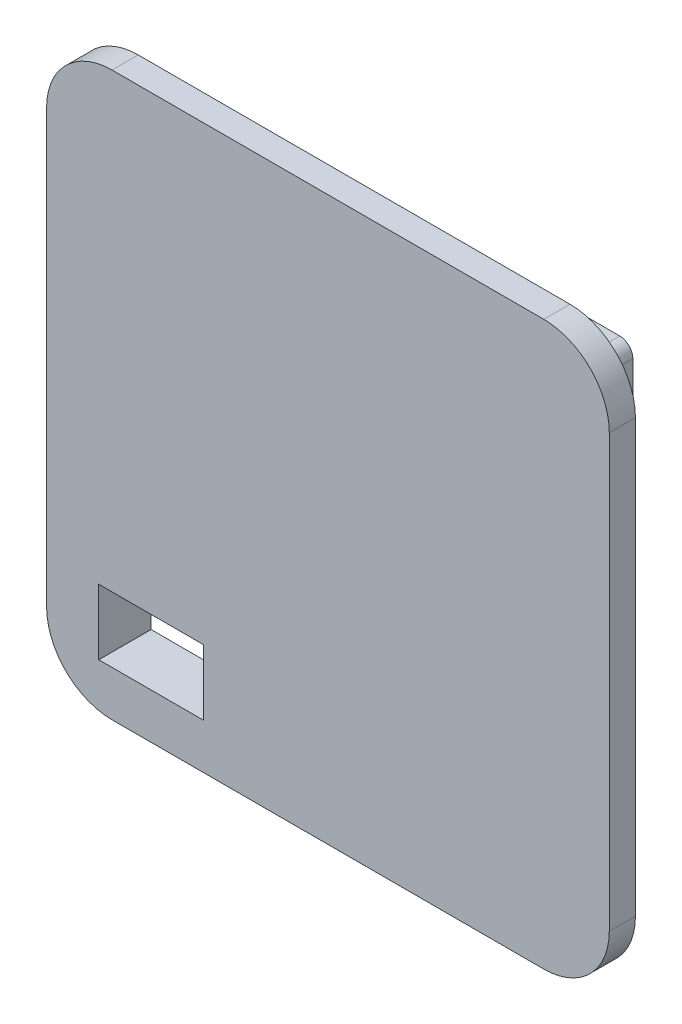
from build123d import *

# Parameters (mm, degrees)
SKETCH1_W           = 43.000000106
SKETCH1_H           = 43
BOSS_EXTRUDE1_DEPTH = 2
FILLET1_R           = 5
SKETCH2_W           = 8
SKETCH2_H           = 5
CUT_EXTRUDE1_DEPTH  = 31.471298008
SKETCH3_W           = 38.6
SKETCH3_H           = 38.6
SKETCH3_W_2         = 5
SKETCH3_H_2         = 8
BOSS_EXTRUDE2_DEPTH = 2
FILLET3_R           = 1


with BuildPart() as part:
    # Sketch1 → Boss-Extrude1 (new body)
    with BuildSketch(Plane(origin=(0, 0, 0), x_dir=(0, 1, 0), z_dir=(0, 0, 1))):
        Rectangle(SKETCH1_W, SKETCH1_H)
    extrude(amount=BOSS_EXTRUDE1_DEPTH)

    # Fillet1
    fillet1_edges = [part.edges().sort_by_distance(p)[0] for p in [
        (-21.5, -21.500000053, 1),
        (-21.5, 21.500000053, 1),
        (21.5, 21.500000053, 1),
        (21.5, -21.500000053, 1),
    ]]
    fillet(fillet1_edges, radius=FILLET1_R)

    # Sketch2 → Cut-Extrude1 (cut, through all)
    with BuildSketch(Plane.XY.offset(2)):
        with Locations((-13.512700472, -15.534578128)):
            Rectangle(SKETCH2_W, SKETCH2_H)
    extrude(amount=-CUT_EXTRUDE1_DEPTH, mode=Mode.SUBTRACT)

    # Sketch3 → Boss-Extrude2 (add)
    with BuildSketch(Plane.YX):
        Rectangle(SKETCH3_W, SKETCH3_H)
        with Locations((-15.534578128, -13.512700472)):
            Rectangle(SKETCH3_W_2, SKETCH3_H_2, mode=Mode.SUBTRACT)
    extrude(amount=BOSS_EXTRUDE2_DEPTH)

    # Fillet3
    fillet3_edges = [part.edges().sort_by_distance(p)[0] for p in [
        (-19.3, -19.3, -1),
        (-19.3, 19.3, -1),
        (19.3, 19.3, -1),
        (19.3, -19.3, -1),
    ]]
    fillet(fillet3_edges, radius=FILLET3_R)


solid = part.part
